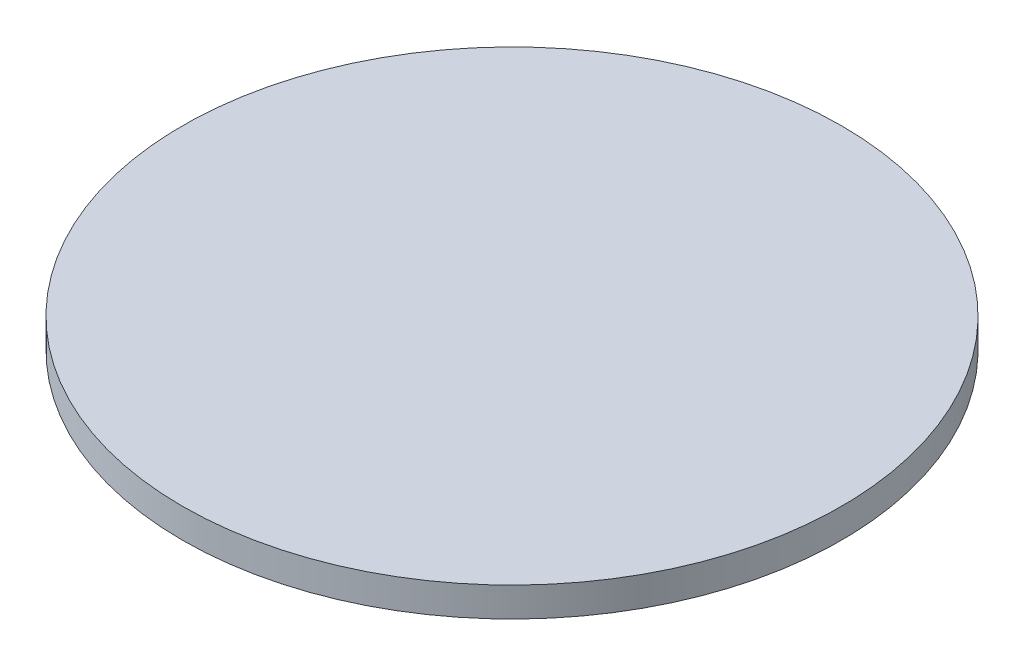
from build123d import *

# Parameters (mm, degrees)
SKETCH1_R           = 1066.8
BOSS_EXTRUDE1_DEPTH = 95.25


with BuildPart() as part:
    # Sketch1 → Boss-Extrude1 (new body)
    with BuildSketch(Plane(origin=(0, 0, 0), x_dir=(1, 0, 0), z_dir=(0, 1, 0))):
        with Locations(Location((0, 0, 0), (0, 0, 270))):
            Circle(SKETCH1_R)
    extrude(amount=BOSS_EXTRUDE1_DEPTH)


solid = part.part
